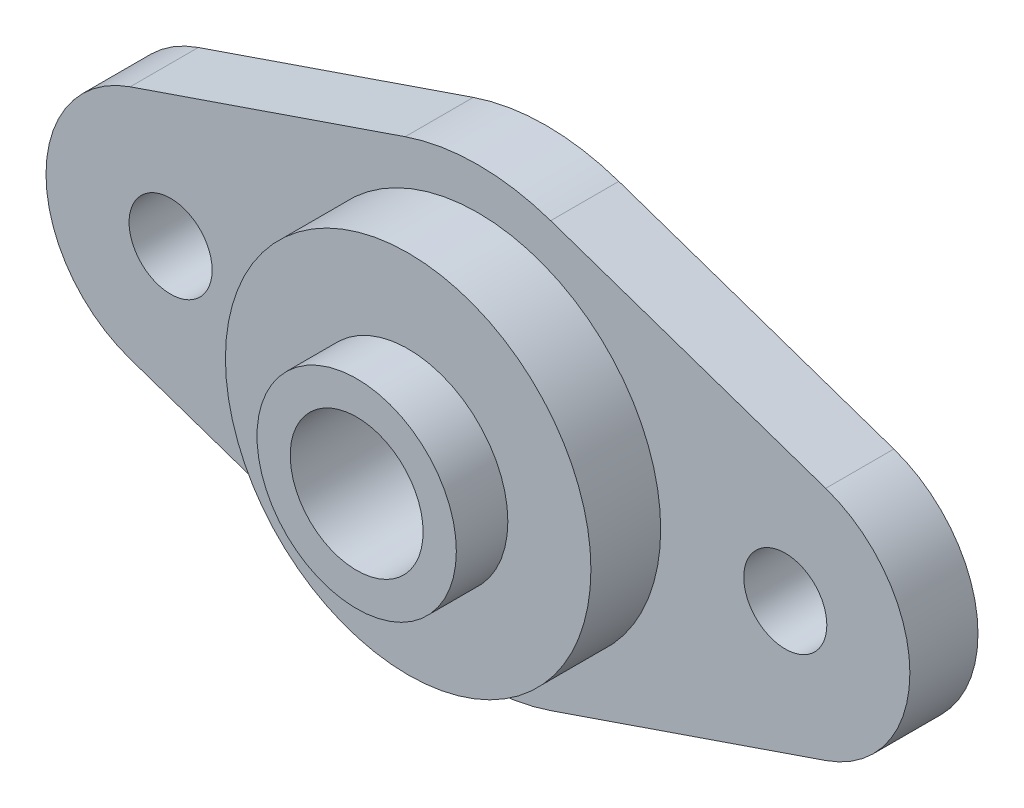
from build123d import *

# Parameters (mm, degrees)
SKETCH2_R           = 4
SKETCH2_R_2         = 2.5
BOSS_EXTRUDE1_DEPTH = 4.1
SKETCH3_R           = 6
SKETCH3_R_2         = 4
BOSS_EXTRUDE2_DEPTH = 11.4
SKETCH4_R           = 11
SKETCH4_R_2         = 6
BOSS_EXTRUDE3_DEPTH = 4.2


with BuildPart() as part:
    # Sketch2 → Boss-Extrude1 (new body)
    with BuildSketch(Plane.XY):
        with BuildLine():
            ThreePointArc((20.932432432, -7.094594595), (26, 0), (20.932432432, 7.094594595))
            Line((20.932432432, 7.094594595), (4.378378378, 12.77027027))
            ThreePointArc((4.378378378, 12.77027027), (0, 13.5), (-4.378378378, 12.77027027))
            Line((-4.378378378, 12.77027027), (-20.932432432, 7.094594595))
            ThreePointArc((-20.932432432, 7.094594595), (-26, 0), (-20.932432432, -7.094594595))
            Line((-20.932432432, -7.094594595), (-4.378378378, -12.77027027))
            ThreePointArc((-4.378378378, -12.77027027), (0, -13.5), (4.378378378, -12.77027027))
            Line((4.378378378, -12.77027027), (20.932432432, -7.094594595))
        make_face()
        Circle(SKETCH2_R, mode=Mode.SUBTRACT)
        with Locations((18.5, 0)):
            Circle(SKETCH2_R_2, mode=Mode.SUBTRACT)
        with Locations((-18.5, 0)):
            Circle(SKETCH2_R_2, mode=Mode.SUBTRACT)
    extrude(amount=BOSS_EXTRUDE1_DEPTH)

    # Sketch3 → Boss-Extrude2 (add)
    with BuildSketch(Plane.XY):
        Circle(SKETCH3_R)
        Circle(SKETCH3_R_2, mode=Mode.SUBTRACT)
    extrude(amount=BOSS_EXTRUDE2_DEPTH)

    # Sketch4 → Boss-Extrude3 (add)
    with BuildSketch(Plane.XY.offset(4.1)):
        Circle(SKETCH4_R)
        Circle(SKETCH4_R_2, mode=Mode.SUBTRACT)
    extrude(amount=BOSS_EXTRUDE3_DEPTH)


solid = part.part
